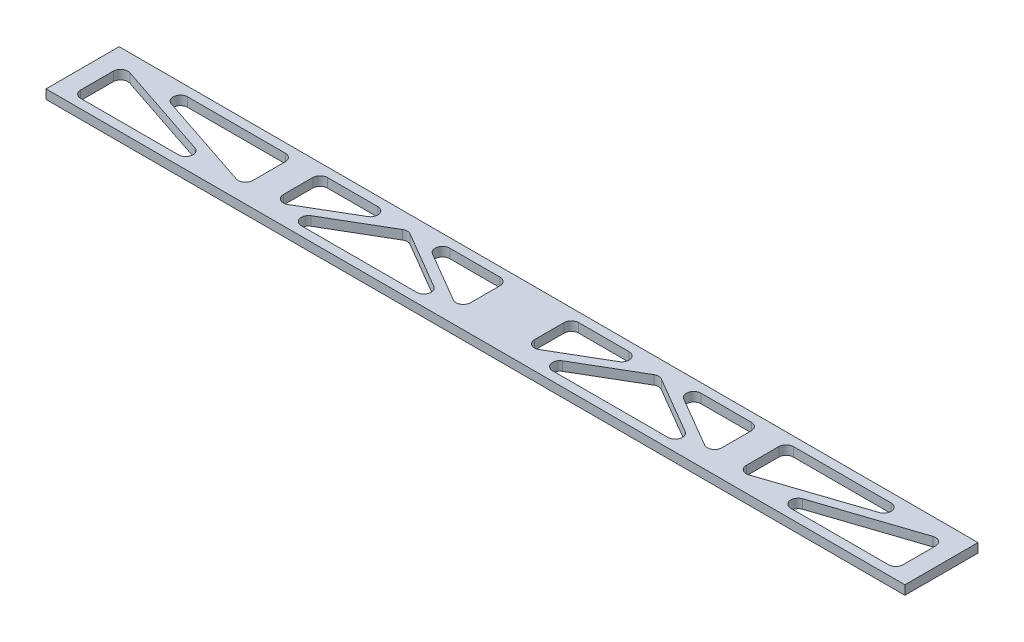
from build123d import *

# Parameters (mm, degrees)
SKETCH1_W           = 298.45
SKETCH1_H           = 25.4
BOSS_EXTRUDE1_DEPTH = 3.175
CUT_EXTRUDE1_DEPTH  = 150.798101623
FILLET1_R           = 2.54


with BuildPart() as part:
    # Sketch1 → Boss-Extrude1 (new body)
    with BuildSketch(Plane(origin=(0, 0, 0), x_dir=(1, 0, 0), z_dir=(0, 1, 0))):
        Rectangle(SKETCH1_W, SKETCH1_H)
    extrude(amount=BOSS_EXTRUDE1_DEPTH)

    # Sketch2 → Cut-Extrude1 (cut, through all)
    with BuildSketch(Plane(origin=(0, 3.175, 0), x_dir=(1, 0, 0), z_dir=(0, 1, 0))):
        Polygon((-142.875, -9.525), (-90.745115786, -9.525), (-142.875, 7.851628071), align=None)
        Polygon((-85.725, -7.851628071), (-85.725, 9.525), (-137.854884214, 9.525), align=None)
        Polygon((-76.2, -7.685517516), (-46.798699244, 9.525), (-76.2, 9.525), align=None)
        Polygon((-73.057550756, -9.525), (-14.254949244, -9.525), (-43.65625, 7.685517516), align=None)
        Polygon((-11.1125, -7.685517516), (-11.1125, 9.525), (-40.513800756, 9.525), align=None)
        Polygon((11.1125, -7.685517516), (40.513800756, 9.525), (11.1125, 9.525), align=None)
        Polygon((14.254949244, -9.525), (73.057550756, -9.525), (43.65625, 7.685517516), align=None)
        Polygon((76.2, -7.685517516), (76.2, 9.525), (46.798699244, 9.525), align=None)
        Polygon((85.725, -7.851628071), (137.854884214, 9.525), (85.725, 9.525), align=None)
        Polygon((90.745115786, -9.525), (142.875, -9.525), (142.875, 7.851628071), align=None)
    extrude(amount=-CUT_EXTRUDE1_DEPTH, mode=Mode.SUBTRACT)

    # Fillet1
    fillet1_edges = [part.edges().sort_by_distance(p)[0] for p in [
        (-43.65625, 1.5875, -7.685517516),
        (-14.254949244, 1.5875, 9.525),
        (-73.057550756, 1.5875, 9.525),
        (-40.513800756, 1.5875, -9.525),
        (-11.1125, 1.5875, -9.525),
        (-11.1125, 1.5875, 7.685517516),
        (-76.2, 1.5875, 7.685517516),
        (-76.2, 1.5875, -9.525),
        (-46.798699244, 1.5875, -9.525),
        (-85.725, 1.5875, 7.851628071),
        (-137.854884214, 1.5875, -9.525),
        (-85.725, 1.5875, -9.525),
        (85.725, 1.5875, 7.851628071),
        (85.725, 1.5875, -9.525),
        (137.854884214, 1.5875, -9.525),
        (46.798699244, 1.5875, -9.525),
        (76.2, 1.5875, -9.525),
        (76.2, 1.5875, 7.685517516),
        (11.1125, 1.5875, 7.685517516),
        (11.1125, 1.5875, -9.525),
        (40.513800756, 1.5875, -9.525),
        (43.65625, 1.5875, -7.685517516),
        (73.057550756, 1.5875, 9.525),
        (14.254949244, 1.5875, 9.525),
        (90.745115786, 1.5875, 9.525),
        (142.875, 1.5875, -7.851628071),
        (142.875, 1.5875, 9.525),
        (-90.745115786, 1.5875, 9.525),
        (-142.875, 1.5875, 9.525),
        (-142.875, 1.5875, -7.851628071),
    ]]
    fillet(fillet1_edges, radius=FILLET1_R)


solid = part.part
